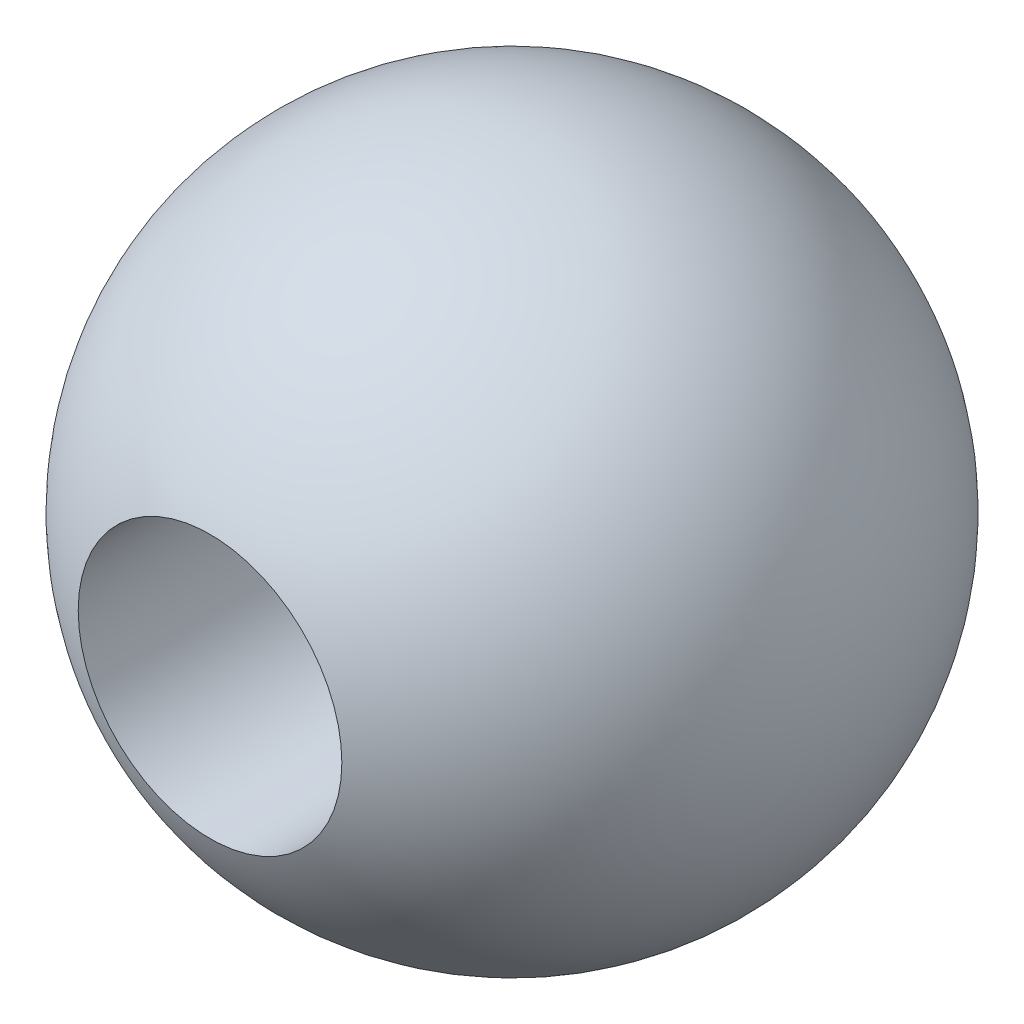
from build123d import *

# Parameters (mm, degrees)
SKETCH2_R          = 2
CUT_EXTRUDE1_DEPTH = 5


with BuildPart() as part:
    # Sketch1 → Revolve2 (revolve)
    with BuildSketch(Plane(origin=(0, 0, 0), x_dir=(1, 0, 0), z_dir=(0, 1, 0))):
        with BuildLine():
            Line((0, -5), (0, 5))
            ThreePointArc((0, 5), (-5, 0), (0, -5))
        make_face()
    revolve(axis=Axis((0, 0, 5), (0, 0, -1)))

    # Sketch2 → Cut-Extrude1 (cut)
    with BuildSketch(Plane.XY.offset(5)):
        Circle(SKETCH2_R)
    extrude(amount=-CUT_EXTRUDE1_DEPTH, mode=Mode.SUBTRACT)


solid = part.part
